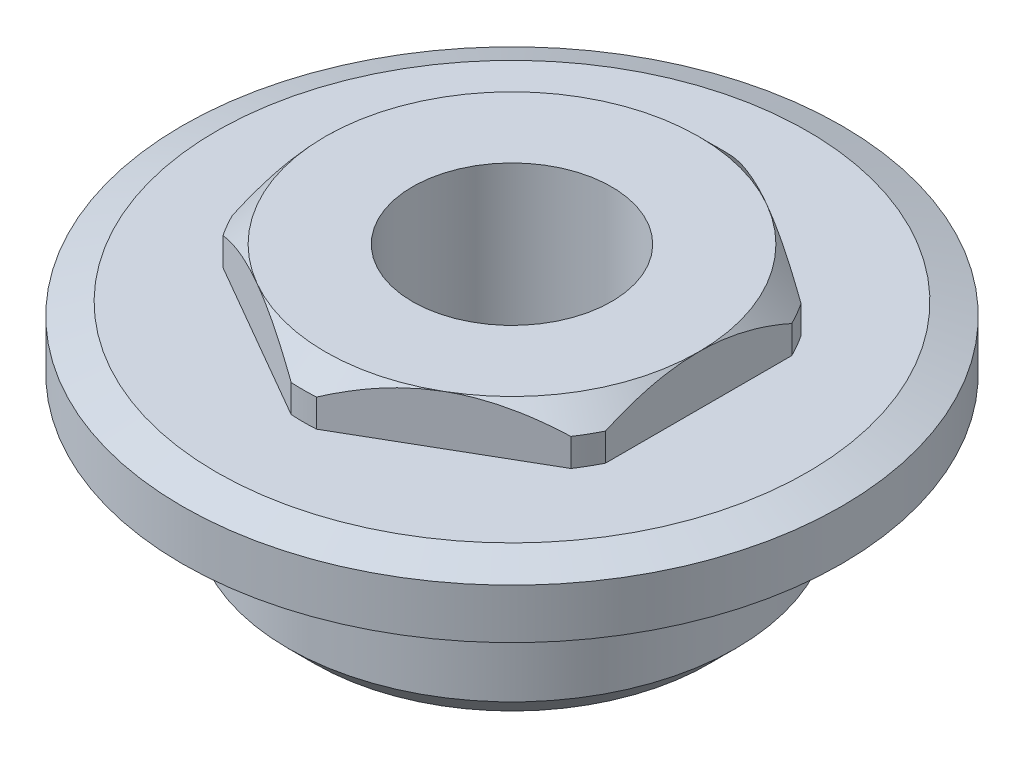
from build123d import *

# Parameters (mm, degrees)
SKETCH_2_W          = 102.444219067
SKETCH_2_H          = 95.84178499
CUT_EXTRUDE_1_DEPTH = 4


with BuildPart() as part:
    # 草图1 → 旋转1 (revolve)
    with BuildSketch(Plane.XY):
        Polygon((8, 21.3), (8, 10), (12.5, 10), (12.5, 0), (15.835, 0), (18, 2.165), (18, 12.3), (26.5, 12.3), (26.5, 16.3), (23.752522581, 17.3), (16.765, 17.3), (16.765, 19.535), (15, 21.3), align=None)
    revolve(axis=Axis((0, 0, 0), (0, 1, 0)))

    # 草图2 → 切除-拉伸1 (cut)
    with BuildSketch(Plane(origin=(0, 21.3, 0), x_dir=(1, 0, 0), z_dir=(0, 1, 0))):
        with Locations((3.088235295, -0.106490872)):
            Rectangle(SKETCH_2_W, SKETCH_2_H)
        Polygon((-15, 8.660254038), (-15, -8.660254038), (0, -17.320508076), (15, -8.660254038), (15, 8.660254038), (0, 17.320508076), align=None, mode=Mode.SUBTRACT)
    extrude(amount=-CUT_EXTRUDE_1_DEPTH, mode=Mode.SUBTRACT)


solid = part.part
